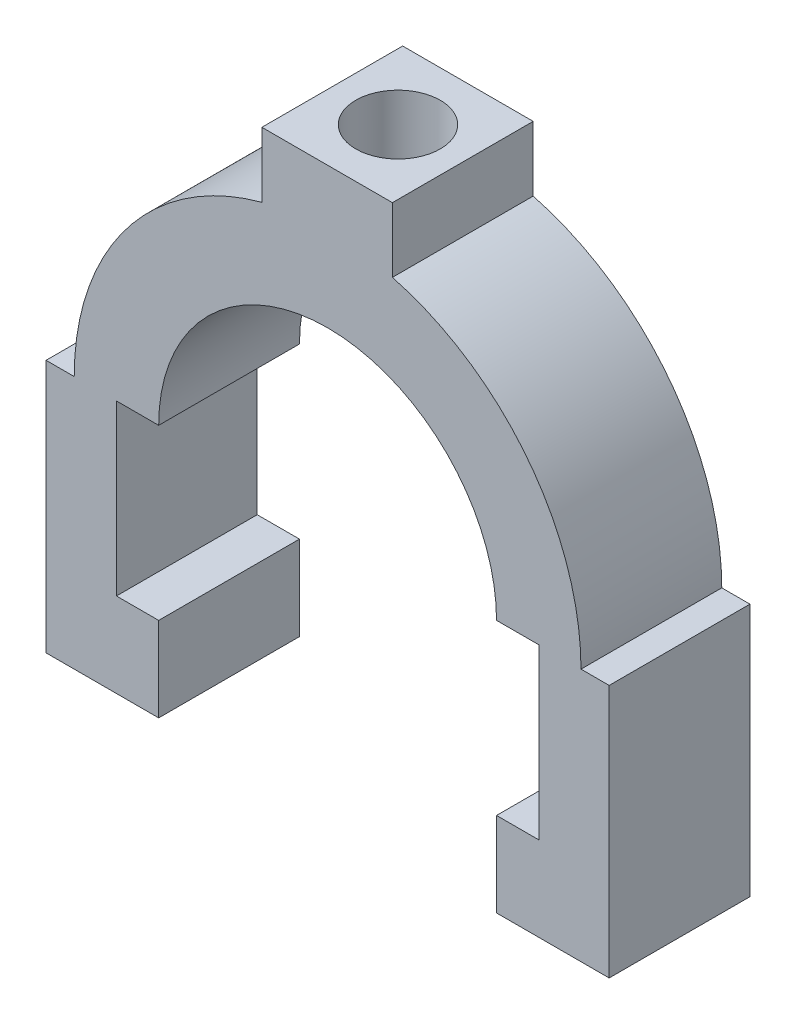
from build123d import *

# Parameters (mm, degrees)
Y_KSEKLIK_EKSTR_ZYON1_DEPTH = 20
IZIM2_R                     = 6
KES_EKSTR_ZYON1_DEPTH       = 92.651513899


with BuildPart() as part:
    # Çizim1 → Yükseklik-Ekstrüzyon1 (new body)
    with BuildSketch(Plane.XY):
        with BuildLine():
            Line((-30, -24), (-30, 0))
            Line((-30, 0), (-24, 0))
            ThreePointArc((-24, 0), (0, 24), (24, 0))
            Line((24, 0), (30, 0))
            Line((30, 0), (30, -24))
            Line((30, -24), (24, -24))
            Line((24, -24), (24, -36))
            Line((24, -36), (33, -36))
            Line((33, -36), (40, -36))
            Line((40, -36), (40, -11.038880633))
            Line((40, -11.038880633), (40, 0))
            Line((40, 0), (36, 0))
            ThreePointArc((36, 0), (28.525322537, 21.961465665), (9.205223658, 34.803216193))
            Line((9.205223658, 34.803216193), (9.205223658, 44))
            Line((9.205223658, 44), (-9.33749561, 44))
            Line((-9.33749561, 44), (-9.33749561, 34.767961915))
            ThreePointArc((-9.33749561, 34.767961915), (-28.567025064, 21.907192404), (-36, 0))
            Line((-36, 0), (-40, 0))
            Line((-40, 0), (-40, -11.038880633))
            Line((-40, -11.038880633), (-40, -36))
            Line((-40, -36), (-33.54247299, -36))
            Line((-33.54247299, -36), (-24, -36))
            Line((-24, -36), (-24, -24))
            Line((-24, -24), (-30, -24))
        make_face()
    extrude(amount=Y_KSEKLIK_EKSTR_ZYON1_DEPTH)

    # Çizim2 → Kes-Ekstrüzyon1 (cut, through all)
    with BuildSketch(Plane(origin=(0, 44, 0), x_dir=(1, 0, 0), z_dir=(0, 1, 0))):
        with Locations(Location((0, -10, 0), (0, 0, 270))):
            Circle(IZIM2_R)
    extrude(amount=-KES_EKSTR_ZYON1_DEPTH, mode=Mode.SUBTRACT)


solid = part.part
